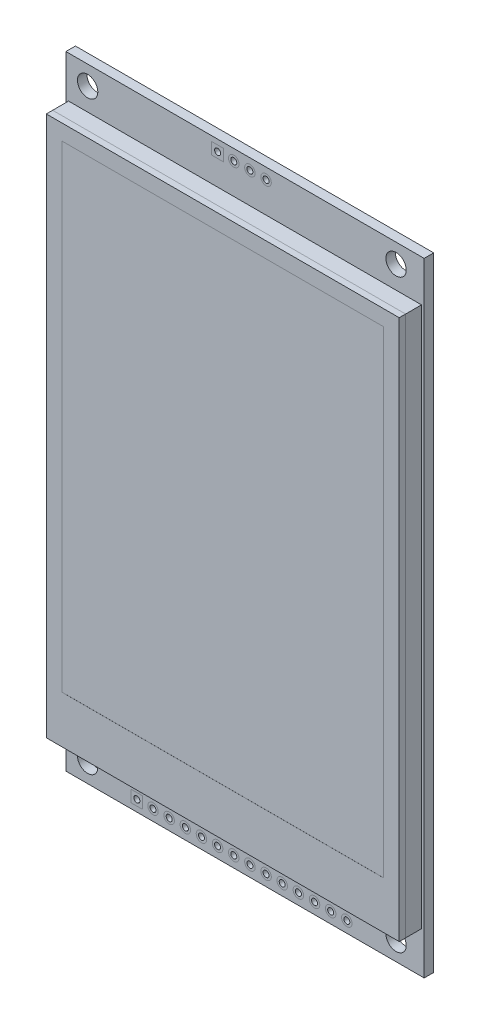
from build123d import *

# Parameters (mm, degrees)
SKETCH_1_W          = 56.34
SKETCH_1_H          = 98
SKETCH_1_R          = 1.6
SKETCH_1_W_2        = 1.85
SKETCH_1_H_2        = 1.85
SKETCH_1_R_2        = 0.825
EXTRUDE_1_DEPTH     = 1.5
SKETCH_1_3_W        = 1.85
SKETCH_1_3_H        = 1.85
SKETCH_1_3_R        = 0.475
EXTRUDE_2_DEPTH     = 1.5
EXTRUDE_2_2_DEPTH   = 1.5
SKETCH_1_3_R_2      = 0.825
EXTRUDE_2_3_DEPTH   = 1.5
EXTRUDE_2_4_DEPTH   = 1.5
EXTRUDE_2_5_DEPTH   = 1.5
EXTRUDE_2_6_DEPTH   = 1.5
EXTRUDE_2_7_DEPTH   = 1.5
EXTRUDE_2_8_DEPTH   = 1.5
EXTRUDE_2_9_DEPTH   = 1.5
EXTRUDE_2_10_DEPTH  = 1.5
EXTRUDE_2_11_DEPTH  = 1.5
EXTRUDE_2_12_DEPTH  = 1.5
EXTRUDE_2_13_DEPTH  = 1.5
EXTRUDE_2_14_DEPTH  = 1.5
EXTRUDE_2_15_DEPTH  = 1.5
EXTRUDE_2_16_DEPTH  = 1.5
EXTRUDE_2_17_DEPTH  = 1.5
EXTRUDE_2_18_DEPTH  = 1.5
SKETCH_2_W          = 55.5
SKETCH_2_H          = 84.96
EXTRUDE_3_DEPTH     = 2.5
SKETCH_3_W          = 55.5
SKETCH_3_H          = 84.96
EXTRUDE_4_DEPTH     = 1
SKETCH_4_W          = 50.58
SKETCH_4_H          = 75.06
CUT_EXTRUDE_1_DEPTH = 0.01
SKETCH_8_W          = 1.4
SKETCH_8_H          = 0.7
EXTRUDE_5_DEPTH     = 0.8
EXTRUDE_5_2_DEPTH   = 0.8
EXTRUDE_5_3_DEPTH   = 0.8
EXTRUDE_5_4_DEPTH   = 0.8
EXTRUDE_5_5_DEPTH   = 0.8
EXTRUDE_5_6_DEPTH   = 0.8
EXTRUDE_5_7_DEPTH   = 0.8
EXTRUDE_5_8_DEPTH   = 0.8
SKETCH_8_W_2        = 1
SKETCH_8_H_2        = 2.6
EXTRUDE_5_9_DEPTH   = 0.8
SKETCH_8_W_3        = 2.6
SKETCH_8_H_3        = 1
EXTRUDE_5_10_DEPTH  = 0.8
SKETCH_8_W_4        = 5.034309877
SKETCH_8_H_4        = 4.138154648
EXTRUDE_5_11_DEPTH  = 0.8
SKETCH_9_W          = 0.25
SKETCH_9_H          = 0.65
EXTRUDE_6_DEPTH     = 0.35
EXTRUDE_6_2_DEPTH   = 0.35
EXTRUDE_6_3_DEPTH   = 0.35
EXTRUDE_6_4_DEPTH   = 0.35
EXTRUDE_6_5_DEPTH   = 0.35
EXTRUDE_6_6_DEPTH   = 0.35
EXTRUDE_6_7_DEPTH   = 0.35
EXTRUDE_6_8_DEPTH   = 0.35
EXTRUDE_6_9_DEPTH   = 0.35
EXTRUDE_6_10_DEPTH  = 0.35
EXTRUDE_6_11_DEPTH  = 0.35
EXTRUDE_6_12_DEPTH  = 0.35
EXTRUDE_6_13_DEPTH  = 0.35
EXTRUDE_6_14_DEPTH  = 0.35
EXTRUDE_6_15_DEPTH  = 0.35
EXTRUDE_6_16_DEPTH  = 0.35
SKETCH_9_W_2        = 0.4
SKETCH_9_H_2        = 1
EXTRUDE_6_17_DEPTH  = 0.35
EXTRUDE_6_18_DEPTH  = 0.35
EXTRUDE_6_19_DEPTH  = 0.35
SKETCH_9_W_3        = 1
SKETCH_9_H_3        = 0.4
EXTRUDE_6_20_DEPTH  = 0.35
EXTRUDE_6_21_DEPTH  = 0.35
EXTRUDE_6_22_DEPTH  = 0.35


with BuildPart() as part:
    # Эскиз1 → Бобышка-Вытянуть1 (new body)
    with BuildSketch(Plane.XY):
        with Locations((28.17, 49)):
            Rectangle(SKETCH_1_W, SKETCH_1_H)
        with Locations((3.42, 3)):
            Circle(SKETCH_1_R, mode=Mode.SUBTRACT)
        with Locations((11.16, 1.74)):
            Rectangle(SKETCH_1_W_2, SKETCH_1_H_2, mode=Mode.SUBTRACT)
        with Locations((13.7, 1.74)):
            Circle(SKETCH_1_R_2, mode=Mode.SUBTRACT)
        with Locations((16.24, 1.74)):
            Circle(SKETCH_1_R_2, mode=Mode.SUBTRACT)
        with Locations((18.78, 1.74)):
            Circle(SKETCH_1_R_2, mode=Mode.SUBTRACT)
        with Locations((21.32, 1.74)):
            Circle(SKETCH_1_R_2, mode=Mode.SUBTRACT)
        with Locations((23.86, 1.74)):
            Circle(SKETCH_1_R_2, mode=Mode.SUBTRACT)
        with Locations((26.4, 1.74)):
            Circle(SKETCH_1_R_2, mode=Mode.SUBTRACT)
        with Locations((28.94, 1.74)):
            Circle(SKETCH_1_R_2, mode=Mode.SUBTRACT)
        with Locations((31.48, 1.74)):
            Circle(SKETCH_1_R_2, mode=Mode.SUBTRACT)
        with Locations((34.02, 1.74)):
            Circle(SKETCH_1_R_2, mode=Mode.SUBTRACT)
        with Locations((36.56, 1.74)):
            Circle(SKETCH_1_R_2, mode=Mode.SUBTRACT)
        with Locations((39.1, 1.74)):
            Circle(SKETCH_1_R_2, mode=Mode.SUBTRACT)
        with Locations((41.64, 1.74)):
            Circle(SKETCH_1_R_2, mode=Mode.SUBTRACT)
        with Locations((44.18, 1.74)):
            Circle(SKETCH_1_R_2, mode=Mode.SUBTRACT)
        with Locations((51.92, 3)):
            Circle(SKETCH_1_R, mode=Mode.SUBTRACT)
        with Locations((3.42, 95)):
            Circle(SKETCH_1_R, mode=Mode.SUBTRACT)
        with Locations((23.86, 96.28)):
            Rectangle(SKETCH_1_W_2, SKETCH_1_H_2, mode=Mode.SUBTRACT)
        with Locations((26.4, 96.28)):
            Circle(SKETCH_1_R_2, mode=Mode.SUBTRACT)
        with Locations((28.94, 96.28)):
            Circle(SKETCH_1_R_2, mode=Mode.SUBTRACT)
        with Locations((31.48, 96.28)):
            Circle(SKETCH_1_R_2, mode=Mode.SUBTRACT)
        with Locations((51.92, 95)):
            Circle(SKETCH_1_R, mode=Mode.SUBTRACT)
    extrude(amount=EXTRUDE_1_DEPTH)


with BuildPart() as body_2:
    # Эскиз1<3> → Бобышка-Вытянуть2 (new body)
    with BuildSketch(Plane.XY):
        with Locations((11.16, 1.74)):
            Rectangle(SKETCH_1_3_W, SKETCH_1_3_H)
        with Locations((11.16, 1.74)):
            Circle(SKETCH_1_3_R, mode=Mode.SUBTRACT)
    extrude(amount=EXTRUDE_2_DEPTH)


with BuildPart() as body_3:
    # Эскиз1<3> → Extrude 2 2 (new body)
    with BuildSketch(Plane.XY):
        with Locations((23.86, 96.28)):
            Rectangle(SKETCH_1_3_W, SKETCH_1_3_H)
        with Locations((23.86, 96.28)):
            Circle(SKETCH_1_3_R, mode=Mode.SUBTRACT)
    extrude(amount=EXTRUDE_2_2_DEPTH)


with BuildPart() as body_4:
    # Эскиз1<3> → Extrude 2 3 (new body)
    with BuildSketch(Plane.XY):
        with Locations((26.4, 96.28)):
            Circle(SKETCH_1_3_R_2)
        with Locations((26.4, 96.28)):
            Circle(SKETCH_1_3_R, mode=Mode.SUBTRACT)
    extrude(amount=EXTRUDE_2_3_DEPTH)


with BuildPart() as body_5:
    # Эскиз1<3> → Extrude 2 4 (new body)
    with BuildSketch(Plane.XY):
        with Locations((31.48, 96.28)):
            Circle(SKETCH_1_3_R_2)
        with Locations((31.48, 96.28)):
            Circle(SKETCH_1_3_R, mode=Mode.SUBTRACT)
    extrude(amount=EXTRUDE_2_4_DEPTH)


with BuildPart() as body_6:
    # Эскиз1<3> → Extrude 2 5 (new body)
    with BuildSketch(Plane.XY):
        with Locations((28.94, 96.28)):
            Circle(SKETCH_1_3_R_2)
        with Locations((28.94, 96.28)):
            Circle(SKETCH_1_3_R, mode=Mode.SUBTRACT)
    extrude(amount=EXTRUDE_2_5_DEPTH)


with BuildPart() as body_7:
    # Эскиз1<3> → Extrude 2 6 (new body)
    with BuildSketch(Plane.XY):
        with Locations((13.7, 1.74)):
            Circle(SKETCH_1_3_R_2)
        with Locations((13.7, 1.74)):
            Circle(SKETCH_1_3_R, mode=Mode.SUBTRACT)
    extrude(amount=EXTRUDE_2_6_DEPTH)


with BuildPart() as body_8:
    # Эскиз1<3> → Extrude 2 7 (new body)
    with BuildSketch(Plane.XY):
        with Locations((16.24, 1.74)):
            Circle(SKETCH_1_3_R_2)
        with Locations((16.24, 1.74)):
            Circle(SKETCH_1_3_R, mode=Mode.SUBTRACT)
    extrude(amount=EXTRUDE_2_7_DEPTH)


with BuildPart() as body_9:
    # Эскиз1<3> → Extrude 2 8 (new body)
    with BuildSketch(Plane.XY):
        with Locations((18.78, 1.74)):
            Circle(SKETCH_1_3_R_2)
        with Locations((18.78, 1.74)):
            Circle(SKETCH_1_3_R, mode=Mode.SUBTRACT)
    extrude(amount=EXTRUDE_2_8_DEPTH)


with BuildPart() as body_10:
    # Эскиз1<3> → Extrude 2 9 (new body)
    with BuildSketch(Plane.XY):
        with Locations((21.32, 1.74)):
            Circle(SKETCH_1_3_R_2)
        with Locations((21.32, 1.74)):
            Circle(SKETCH_1_3_R, mode=Mode.SUBTRACT)
    extrude(amount=EXTRUDE_2_9_DEPTH)


with BuildPart() as body_11:
    # Эскиз1<3> → Extrude 2 10 (new body)
    with BuildSketch(Plane.XY):
        with Locations((23.86, 1.74)):
            Circle(SKETCH_1_3_R_2)
        with Locations((23.86, 1.74)):
            Circle(SKETCH_1_3_R, mode=Mode.SUBTRACT)
    extrude(amount=EXTRUDE_2_10_DEPTH)


with BuildPart() as body_12:
    # Эскиз1<3> → Extrude 2 11 (new body)
    with BuildSketch(Plane.XY):
        with Locations((26.4, 1.74)):
            Circle(SKETCH_1_3_R_2)
        with Locations((26.4, 1.74)):
            Circle(SKETCH_1_3_R, mode=Mode.SUBTRACT)
    extrude(amount=EXTRUDE_2_11_DEPTH)


with BuildPart() as body_13:
    # Эскиз1<3> → Extrude 2 12 (new body)
    with BuildSketch(Plane.XY):
        with Locations((28.94, 1.74)):
            Circle(SKETCH_1_3_R_2)
        with Locations((28.94, 1.74)):
            Circle(SKETCH_1_3_R, mode=Mode.SUBTRACT)
    extrude(amount=EXTRUDE_2_12_DEPTH)


with BuildPart() as body_14:
    # Эскиз1<3> → Extrude 2 13 (new body)
    with BuildSketch(Plane.XY):
        with Locations((31.48, 1.74)):
            Circle(SKETCH_1_3_R_2)
        with Locations((31.48, 1.74)):
            Circle(SKETCH_1_3_R, mode=Mode.SUBTRACT)
    extrude(amount=EXTRUDE_2_13_DEPTH)


with BuildPart() as body_15:
    # Эскиз1<3> → Extrude 2 14 (new body)
    with BuildSketch(Plane.XY):
        with Locations((34.02, 1.74)):
            Circle(SKETCH_1_3_R_2)
        with Locations((34.02, 1.74)):
            Circle(SKETCH_1_3_R, mode=Mode.SUBTRACT)
    extrude(amount=EXTRUDE_2_14_DEPTH)


with BuildPart() as body_16:
    # Эскиз1<3> → Extrude 2 15 (new body)
    with BuildSketch(Plane.XY):
        with Locations((36.56, 1.74)):
            Circle(SKETCH_1_3_R_2)
        with Locations((36.56, 1.74)):
            Circle(SKETCH_1_3_R, mode=Mode.SUBTRACT)
    extrude(amount=EXTRUDE_2_15_DEPTH)


with BuildPart() as body_17:
    # Эскиз1<3> → Extrude 2 16 (new body)
    with BuildSketch(Plane.XY):
        with Locations((39.1, 1.74)):
            Circle(SKETCH_1_3_R_2)
        with Locations((39.1, 1.74)):
            Circle(SKETCH_1_3_R, mode=Mode.SUBTRACT)
    extrude(amount=EXTRUDE_2_16_DEPTH)


with BuildPart() as body_18:
    # Эскиз1<3> → Extrude 2 17 (new body)
    with BuildSketch(Plane.XY):
        with Locations((41.64, 1.74)):
            Circle(SKETCH_1_3_R_2)
        with Locations((41.64, 1.74)):
            Circle(SKETCH_1_3_R, mode=Mode.SUBTRACT)
    extrude(amount=EXTRUDE_2_17_DEPTH)


with BuildPart() as body_19:
    # Эскиз1<3> → Extrude 2 18 (new body)
    with BuildSketch(Plane.XY):
        with Locations((44.18, 1.74)):
            Circle(SKETCH_1_3_R_2)
        with Locations((44.18, 1.74)):
            Circle(SKETCH_1_3_R, mode=Mode.SUBTRACT)
    extrude(amount=EXTRUDE_2_18_DEPTH)


with BuildPart() as body_20:
    # Эскиз2 → Бобышка-Вытянуть3 (new body)
    with BuildSketch(Plane.XY.offset(1.5)):
        with Locations((28.17, 48.98)):
            Rectangle(SKETCH_2_W, SKETCH_2_H)
    extrude(amount=EXTRUDE_3_DEPTH)


with BuildPart() as body_21:
    # Эскиз3 → Бобышка-Вытянуть4 (new body)
    with BuildSketch(Plane.XY.offset(4)):
        with Locations((28.17, 48.98)):
            Rectangle(SKETCH_3_W, SKETCH_3_H)
    extrude(amount=EXTRUDE_4_DEPTH)

    # Эскиз4 → Вырез-Вытянуть1 (cut)
    with BuildSketch(Plane.XY.offset(5)):
        with Locations((28.17, 51.47)):
            Rectangle(SKETCH_4_W, SKETCH_4_H)
    extrude(amount=-CUT_EXTRUDE_1_DEPTH, mode=Mode.SUBTRACT)


with BuildPart() as body_22:
    # Эскиз8 → Бобышка-Вытянуть5 (new body)
    with BuildSketch(Plane(origin=(0, 0, 0), x_dir=(-1, 0, 0), z_dir=(0, 0, -1))):
        with Locations((-28.648300517, 67.874698298)):
            Rectangle(SKETCH_8_W, SKETCH_8_H)
    extrude(amount=EXTRUDE_5_DEPTH)


with BuildPart() as body_23:
    # Эскиз8 → Extrude 5 2 (new body)
    with BuildSketch(Plane(origin=(0, 0, 0), x_dir=(-1, 0, 0), z_dir=(0, 0, -1))):
        with Locations((-28.648300517, 65.468658196)):
            Rectangle(SKETCH_8_W, SKETCH_8_H)
    extrude(amount=EXTRUDE_5_2_DEPTH)


with BuildPart() as body_24:
    # Эскиз8 → Extrude 5 3 (new body)
    with BuildSketch(Plane(origin=(0, 0, 0), x_dir=(-1, 0, 0), z_dir=(0, 0, -1))):
        with Locations((-28.648300517, 63.130361908)):
            Rectangle(SKETCH_8_W, SKETCH_8_H)
    extrude(amount=EXTRUDE_5_3_DEPTH)


with BuildPart() as body_25:
    # Эскиз8 → Extrude 5 4 (new body)
    with BuildSketch(Plane(origin=(0, 0, 0), x_dir=(-1, 0, 0), z_dir=(0, 0, -1))):
        with Locations((-42.328769683, 23.077667261)):
            Rectangle(SKETCH_8_W, SKETCH_8_H)
    extrude(amount=EXTRUDE_5_4_DEPTH)


with BuildPart() as body_26:
    # Эскиз8 → Extrude 5 5 (new body)
    with BuildSketch(Plane(origin=(0, 0, 0), x_dir=(-1, 0, 0), z_dir=(0, 0, -1))):
        with Locations((-42.352242595, 15.871711671)):
            Rectangle(SKETCH_8_W, SKETCH_8_H)
    extrude(amount=EXTRUDE_5_5_DEPTH)


with BuildPart() as body_27:
    # Эскиз8 → Extrude 5 6 (new body)
    with BuildSketch(Plane(origin=(0, 0, 0), x_dir=(-1, 0, 0), z_dir=(0, 0, -1))):
        with Locations((-36.321700776, 17.542757854)):
            Rectangle(SKETCH_8_W, SKETCH_8_H)
    extrude(amount=EXTRUDE_5_6_DEPTH)


with BuildPart() as body_28:
    # Эскиз8 → Extrude 5 7 (new body)
    with BuildSketch(Plane(origin=(0, 0, 0), x_dir=(-1, 0, 0), z_dir=(0, 0, -1))):
        with Locations((-36.321700776, 15.895606298)):
            Rectangle(SKETCH_8_W, SKETCH_8_H)
    extrude(amount=EXTRUDE_5_7_DEPTH)


with BuildPart() as body_29:
    # Эскиз8 → Extrude 5 8 (new body)
    with BuildSketch(Plane(origin=(0, 0, 0), x_dir=(-1, 0, 0), z_dir=(0, 0, -1))):
        with Locations((-23.069908162, 21.297194644)):
            Rectangle(SKETCH_8_W, SKETCH_8_H)
    extrude(amount=EXTRUDE_5_8_DEPTH)


with BuildPart() as body_30:
    # Эскиз8 → Extrude 5 9 (new body)
    with BuildSketch(Plane(origin=(0, 0, 0), x_dir=(-1, 0, 0), z_dir=(0, 0, -1))):
        with Locations((-23.115818082, 17.71914673)):
            Rectangle(SKETCH_8_W_2, SKETCH_8_H_2)
    extrude(amount=EXTRUDE_5_9_DEPTH)


with BuildPart() as body_31:
    # Эскиз8 → Extrude 5 10 (new body)
    with BuildSketch(Plane(origin=(0, 0, 0), x_dir=(-1, 0, 0), z_dir=(0, 0, -1))):
        with Locations((-42.363940871, 19.27118153)):
            Rectangle(SKETCH_8_W_3, SKETCH_8_H_3)
    extrude(amount=EXTRUDE_5_10_DEPTH)


with BuildPart() as body_32:
    # Эскиз8 → Extrude 5 11 (new body)
    with BuildSketch(Plane(origin=(0, 0, 0), x_dir=(-1, 0, 0), z_dir=(0, 0, -1))):
        with Locations((-31.03660737, 20.003429823)):
            Rectangle(SKETCH_8_W_4, SKETCH_8_H_4)
    extrude(amount=EXTRUDE_5_11_DEPTH)


with BuildPart() as body_33:
    # Эскиз9 → Бобышка-Вытянуть6 (new body)
    with BuildSketch(Plane(origin=(0, 0, 0), x_dir=(-1, 0, 0), z_dir=(0, 0, -1))):
        with Locations((-33.253762308, 22.397507147)):
            Rectangle(SKETCH_9_W, SKETCH_9_H)
    extrude(amount=EXTRUDE_6_DEPTH)


with BuildPart() as body_34:
    # Эскиз9 → Extrude 6 2 (new body)
    with BuildSketch(Plane(origin=(0, 0, 0), x_dir=(-1, 0, 0), z_dir=(0, 0, -1))):
        with Locations((-32.620289468, 22.397507147)):
            Rectangle(SKETCH_9_W, SKETCH_9_H)
    extrude(amount=EXTRUDE_6_2_DEPTH)


with BuildPart() as body_35:
    # Эскиз9 → Extrude 6 3 (new body)
    with BuildSketch(Plane(origin=(0, 0, 0), x_dir=(-1, 0, 0), z_dir=(0, 0, -1))):
        with Locations((-31.986816629, 22.397507147)):
            Rectangle(SKETCH_9_W, SKETCH_9_H)
    extrude(amount=EXTRUDE_6_3_DEPTH)


with BuildPart() as body_36:
    # Эскиз9 → Extrude 6 4 (new body)
    with BuildSketch(Plane(origin=(0, 0, 0), x_dir=(-1, 0, 0), z_dir=(0, 0, -1))):
        with Locations((-31.353343789, 22.397507147)):
            Rectangle(SKETCH_9_W, SKETCH_9_H)
    extrude(amount=EXTRUDE_6_4_DEPTH)


with BuildPart() as body_37:
    # Эскиз9 → Extrude 6 5 (new body)
    with BuildSketch(Plane(origin=(0, 0, 0), x_dir=(-1, 0, 0), z_dir=(0, 0, -1))):
        with Locations((-30.71987095, 22.397507147)):
            Rectangle(SKETCH_9_W, SKETCH_9_H)
    extrude(amount=EXTRUDE_6_5_DEPTH)


with BuildPart() as body_38:
    # Эскиз9 → Extrude 6 6 (new body)
    with BuildSketch(Plane(origin=(0, 0, 0), x_dir=(-1, 0, 0), z_dir=(0, 0, -1))):
        with Locations((-30.08639811, 22.397507147)):
            Rectangle(SKETCH_9_W, SKETCH_9_H)
    extrude(amount=EXTRUDE_6_6_DEPTH)


with BuildPart() as body_39:
    # Эскиз9 → Extrude 6 7 (new body)
    with BuildSketch(Plane(origin=(0, 0, 0), x_dir=(-1, 0, 0), z_dir=(0, 0, -1))):
        with Locations((-29.452925271, 22.397507147)):
            Rectangle(SKETCH_9_W, SKETCH_9_H)
    extrude(amount=EXTRUDE_6_7_DEPTH)


with BuildPart() as body_40:
    # Эскиз9 → Extrude 6 8 (new body)
    with BuildSketch(Plane(origin=(0, 0, 0), x_dir=(-1, 0, 0), z_dir=(0, 0, -1))):
        with Locations((-28.819452431, 22.397507147)):
            Rectangle(SKETCH_9_W, SKETCH_9_H)
    extrude(amount=EXTRUDE_6_8_DEPTH)


with BuildPart() as body_41:
    # Эскиз9 → Extrude 6 9 (new body)
    with BuildSketch(Plane(origin=(0, 0, 0), x_dir=(-1, 0, 0), z_dir=(0, 0, -1))):
        with Locations((-28.819452431, 17.609352499)):
            Rectangle(SKETCH_9_W, SKETCH_9_H)
    extrude(amount=EXTRUDE_6_9_DEPTH)


with BuildPart() as body_42:
    # Эскиз9 → Extrude 6 10 (new body)
    with BuildSketch(Plane(origin=(0, 0, 0), x_dir=(-1, 0, 0), z_dir=(0, 0, -1))):
        with Locations((-29.452925271, 17.609352499)):
            Rectangle(SKETCH_9_W, SKETCH_9_H)
    extrude(amount=EXTRUDE_6_10_DEPTH)


with BuildPart() as body_43:
    # Эскиз9 → Extrude 6 11 (new body)
    with BuildSketch(Plane(origin=(0, 0, 0), x_dir=(-1, 0, 0), z_dir=(0, 0, -1))):
        with Locations((-30.08639811, 17.609352499)):
            Rectangle(SKETCH_9_W, SKETCH_9_H)
    extrude(amount=EXTRUDE_6_11_DEPTH)


with BuildPart() as body_44:
    # Эскиз9 → Extrude 6 12 (new body)
    with BuildSketch(Plane(origin=(0, 0, 0), x_dir=(-1, 0, 0), z_dir=(0, 0, -1))):
        with Locations((-30.71987095, 17.609352499)):
            Rectangle(SKETCH_9_W, SKETCH_9_H)
    extrude(amount=EXTRUDE_6_12_DEPTH)


with BuildPart() as body_45:
    # Эскиз9 → Extrude 6 13 (new body)
    with BuildSketch(Plane(origin=(0, 0, 0), x_dir=(-1, 0, 0), z_dir=(0, 0, -1))):
        with Locations((-31.353343789, 17.609352499)):
            Rectangle(SKETCH_9_W, SKETCH_9_H)
    extrude(amount=EXTRUDE_6_13_DEPTH)


with BuildPart() as body_46:
    # Эскиз9 → Extrude 6 14 (new body)
    with BuildSketch(Plane(origin=(0, 0, 0), x_dir=(-1, 0, 0), z_dir=(0, 0, -1))):
        with Locations((-31.986816629, 17.609352499)):
            Rectangle(SKETCH_9_W, SKETCH_9_H)
    extrude(amount=EXTRUDE_6_14_DEPTH)


with BuildPart() as body_47:
    # Эскиз9 → Extrude 6 15 (new body)
    with BuildSketch(Plane(origin=(0, 0, 0), x_dir=(-1, 0, 0), z_dir=(0, 0, -1))):
        with Locations((-32.620289468, 17.609352499)):
            Rectangle(SKETCH_9_W, SKETCH_9_H)
    extrude(amount=EXTRUDE_6_15_DEPTH)


with BuildPart() as body_48:
    # Эскиз9 → Extrude 6 16 (new body)
    with BuildSketch(Plane(origin=(0, 0, 0), x_dir=(-1, 0, 0), z_dir=(0, 0, -1))):
        with Locations((-33.253762308, 17.609352499)):
            Rectangle(SKETCH_9_W, SKETCH_9_H)
    extrude(amount=EXTRUDE_6_16_DEPTH)


with BuildPart() as body_49:
    # Эскиз9 → Extrude 6 17 (new body)
    with BuildSketch(Plane(origin=(0, 0, 0), x_dir=(-1, 0, 0), z_dir=(0, 0, -1))):
        with Locations((-42.363940871, 20.27118153)):
            Rectangle(SKETCH_9_W_2, SKETCH_9_H_2)
    extrude(amount=EXTRUDE_6_17_DEPTH)


with BuildPart() as body_50:
    # Эскиз9 → Extrude 6 18 (new body)
    with BuildSketch(Plane(origin=(0, 0, 0), x_dir=(-1, 0, 0), z_dir=(0, 0, -1))):
        with Locations((-43.313940871, 18.27118153)):
            Rectangle(SKETCH_9_W_2, SKETCH_9_H_2)
    extrude(amount=EXTRUDE_6_18_DEPTH)


with BuildPart() as body_51:
    # Эскиз9 → Extrude 6 19 (new body)
    with BuildSketch(Plane(origin=(0, 0, 0), x_dir=(-1, 0, 0), z_dir=(0, 0, -1))):
        with Locations((-41.413940871, 18.27118153)):
            Rectangle(SKETCH_9_W_2, SKETCH_9_H_2)
    extrude(amount=EXTRUDE_6_19_DEPTH)


with BuildPart() as body_52:
    # Эскиз9 → Extrude 6 20 (new body)
    with BuildSketch(Plane(origin=(0, 0, 0), x_dir=(-1, 0, 0), z_dir=(0, 0, -1))):
        with Locations((-24.115818082, 17.71914673)):
            Rectangle(SKETCH_9_W_3, SKETCH_9_H_3)
    extrude(amount=EXTRUDE_6_20_DEPTH)


with BuildPart() as body_53:
    # Эскиз9 → Extrude 6 21 (new body)
    with BuildSketch(Plane(origin=(0, 0, 0), x_dir=(-1, 0, 0), z_dir=(0, 0, -1))):
        with Locations((-22.115818082, 16.76914673)):
            Rectangle(SKETCH_9_W_3, SKETCH_9_H_3)
    extrude(amount=EXTRUDE_6_21_DEPTH)


with BuildPart() as body_54:
    # Эскиз9 → Extrude 6 22 (new body)
    with BuildSketch(Plane(origin=(0, 0, 0), x_dir=(-1, 0, 0), z_dir=(0, 0, -1))):
        with Locations((-22.115818082, 18.66914673)):
            Rectangle(SKETCH_9_W_3, SKETCH_9_H_3)
    extrude(amount=EXTRUDE_6_22_DEPTH)


solid = Compound([part.part, body_2.part, body_3.part, body_4.part, body_5.part, body_6.part, body_7.part, body_8.part, body_9.part, body_10.part, body_11.part, body_12.part, body_13.part, body_14.part, body_15.part, body_16.part, body_17.part, body_18.part, body_19.part, body_20.part, body_21.part, body_22.part, body_23.part, body_24.part, body_25.part, body_26.part, body_27.part, body_28.part, body_29.part, body_30.part, body_31.part, body_32.part, body_33.part, body_34.part, body_35.part, body_36.part, body_37.part, body_38.part, body_39.part, body_40.part, body_41.part, body_42.part, body_43.part, body_44.part, body_45.part, body_46.part, body_47.part, body_48.part, body_49.part, body_50.part, body_51.part, body_52.part, body_53.part, body_54.part])
